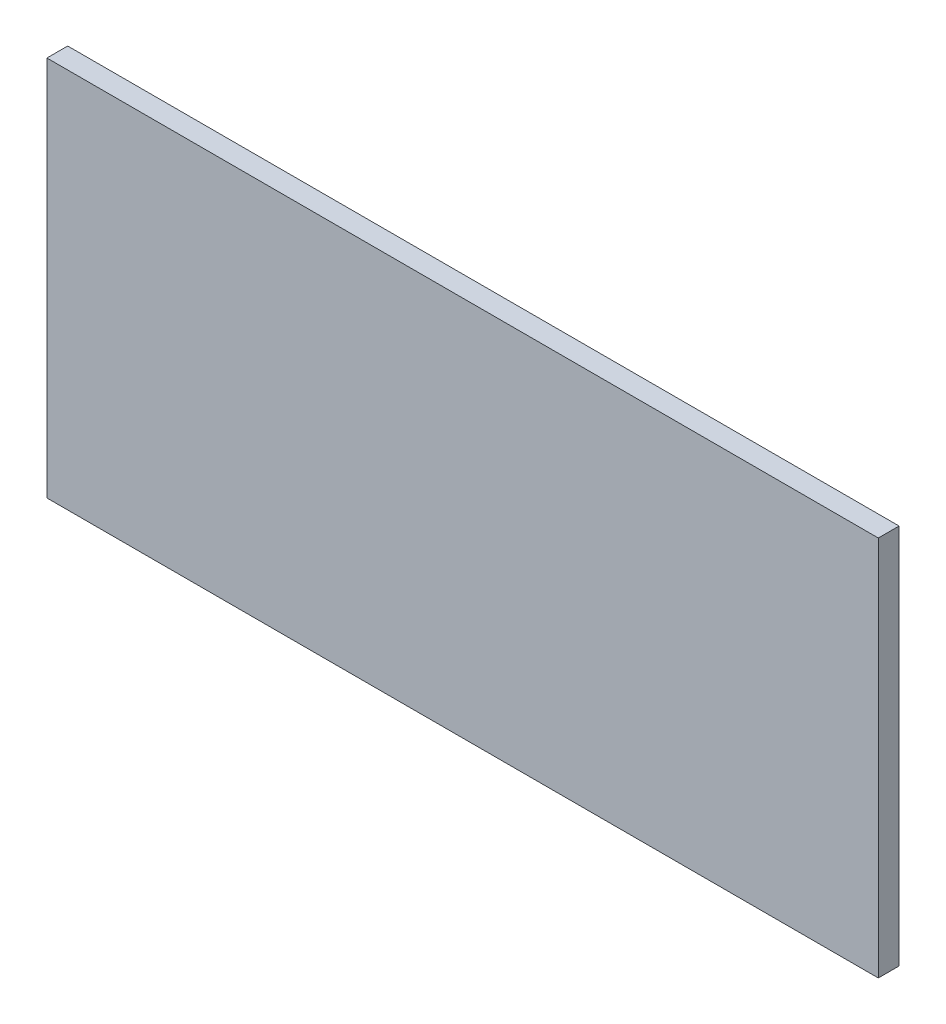
from build123d import *

# Parameters (mm, degrees)
SKETCH1_W           = 120
SKETCH1_H           = 55
BOSS_EXTRUDE1_DEPTH = 3


with BuildPart() as part:
    # Sketch1 → Boss-Extrude1 (new body)
    with BuildSketch(Plane.XY):
        with Locations((60, 27.5)):
            Rectangle(SKETCH1_W, SKETCH1_H)
    extrude(amount=-BOSS_EXTRUDE1_DEPTH)


solid = part.part
